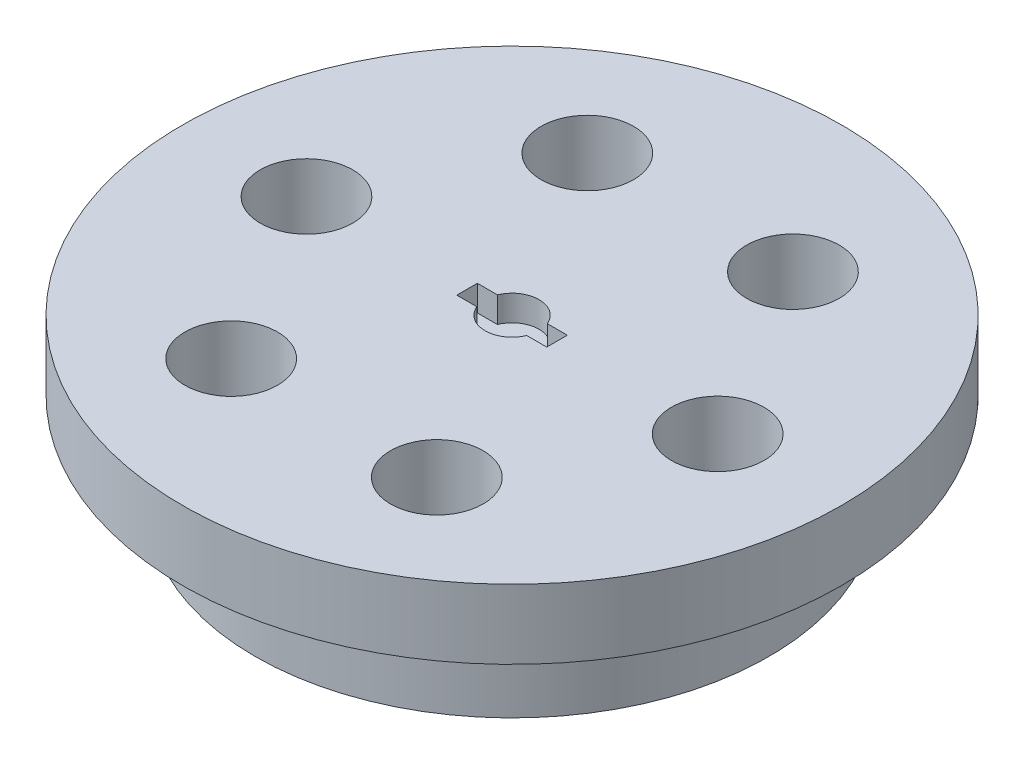
from build123d import *

# Parameters (mm, degrees)
SKETCH1_R           = 20.0025
SKETCH1_R_2         = 7.55
SKETCH1_R_3         = 2.25
BOSS_EXTRUDE1_DEPTH = 7.6
SKETCH9_R           = 7.55
SKETCH9_R_2         = 6.952615
BOSS_EXTRUDE5_DEPTH = 2.6104
SKETCH2_R           = 25.64638
SKETCH2_R_2         = 3.6
BOSS_EXTRUDE2_DEPTH = 5.4
CUT_EXTRUDE1_START  = 8
SKETCH4_R           = 6.952615
CUT_EXTRUDE1_DEPTH  = 8
BOSS_EXTRUDE6_START = -8.0104
SKETCH10_R          = 6.952615
BOSS_EXTRUDE6_DEPTH = 8.0104
CUT_EXTRUDE2_DEPTH  = 2


with BuildPart() as part:
    # Sketch1 → Boss-Extrude1 (new body)
    with BuildSketch(Plane(origin=(0, 60.4104, 0), x_dir=(1, 0, 0), z_dir=(0, 1, 0))):
        with Locations(Location((0, 0, 0), (0, 0, 90))):
            Circle(SKETCH1_R)
        with Locations(Location((0, 0, 0), (0, 0, 90))):
            Circle(SKETCH1_R_2, mode=Mode.SUBTRACT)
        with Locations(Location((-8, 13.856406461, 0), (0, 0, 90))):
            Circle(SKETCH1_R_3, mode=Mode.SUBTRACT)
        with Locations(Location((8, 13.856406461, 0), (0, 0, 90))):
            Circle(SKETCH1_R_3, mode=Mode.SUBTRACT)
        with Locations(Location((16, 0, 0), (0, 0, 90))):
            Circle(SKETCH1_R_3, mode=Mode.SUBTRACT)
        with Locations(Location((8, -13.856406461, 0), (0, 0, 90))):
            Circle(SKETCH1_R_3, mode=Mode.SUBTRACT)
        with Locations(Location((-8, -13.856406461, 0), (0, 0, 90))):
            Circle(SKETCH1_R_3, mode=Mode.SUBTRACT)
        with Locations(Location((-16, 0, 0), (0, 0, 90))):
            Circle(SKETCH1_R_3, mode=Mode.SUBTRACT)
    extrude(amount=BOSS_EXTRUDE1_DEPTH)

    # Sketch9 → Boss-Extrude5 (add)
    with BuildSketch(Plane(origin=(0, 65.4, 0), x_dir=(1, 0, 0), z_dir=(0, 1, 0))):
        with Locations(Location((0, 0, 0), (0, 0, 90))):
            Circle(SKETCH9_R)
        with Locations(Location((0, 0, 0), (0, 0, 270))):
            Circle(SKETCH9_R_2, mode=Mode.SUBTRACT)
    extrude(amount=BOSS_EXTRUDE5_DEPTH)

    # Sketch2 → Boss-Extrude2 (add)
    with BuildSketch(Plane(origin=(0, 68.0104, 0), x_dir=(-1, 0, 0), z_dir=(0, -1, 0))):
        with Locations(Location((0, 0, 0), (0, 0, 180))):
            Circle(SKETCH2_R)
        with Locations(Location((-16, 0, 0), (0, 0, 180))):
            Circle(SKETCH2_R_2, mode=Mode.SUBTRACT)
        with Locations(Location((-8, 13.856406461, 0), (0, 0, 180))):
            Circle(SKETCH2_R_2, mode=Mode.SUBTRACT)
        with Locations(Location((8, 13.856406461, 0), (0, 0, 180))):
            Circle(SKETCH2_R_2, mode=Mode.SUBTRACT)
        with Locations(Location((16, 0, 0), (0, 0, 180))):
            Circle(SKETCH2_R_2, mode=Mode.SUBTRACT)
        with Locations(Location((8, -13.856406461, 0), (0, 0, 180))):
            Circle(SKETCH2_R_2, mode=Mode.SUBTRACT)
        with Locations(Location((-8, -13.856406461, 0), (0, 0, 180))):
            Circle(SKETCH2_R_2, mode=Mode.SUBTRACT)
    extrude(amount=-BOSS_EXTRUDE2_DEPTH)

    # Sketch4 → Cut-Extrude1 (cut)
    with BuildSketch(Plane.XZ.offset(-73.4104).offset(CUT_EXTRUDE1_START)):
        Circle(SKETCH4_R)
    extrude(amount=-CUT_EXTRUDE1_DEPTH, mode=Mode.SUBTRACT)

    # Sketch10 → Boss-Extrude6 (add)
    with BuildSketch(Plane(origin=(0, 73.4104, 0), x_dir=(1, 0, 0), z_dir=(0, 1, 0)).offset(BOSS_EXTRUDE6_START)):
        Circle(SKETCH10_R)
    extrude(amount=BOSS_EXTRUDE6_DEPTH)

    # Sketch11 → Cut-Extrude2 (cut)
    with BuildSketch(Plane(origin=(0, 73.4104, 0), x_dir=(1, 0, 0), z_dir=(0, 1, 0))):
        with BuildLine():
            Line((1.941648784, 0.8), (3.5, 0.8))
            Line((3.5, 0.8), (3.5, -0.8))
            Line((3.5, -0.8), (1.941648784, -0.8))
            ThreePointArc((1.941648784, -0.8), (0, -2.1), (-1.941648784, -0.8))
            Line((-1.941648784, -0.8), (-3.5, -0.8))
            Line((-3.5, -0.8), (-3.5, 0.8))
            Line((-3.5, 0.8), (-1.941648784, 0.8))
            ThreePointArc((-1.941648784, 0.8), (0, 2.1), (1.941648784, 0.8))
        make_face()
    extrude(amount=-CUT_EXTRUDE2_DEPTH, mode=Mode.SUBTRACT)


solid = part.part
